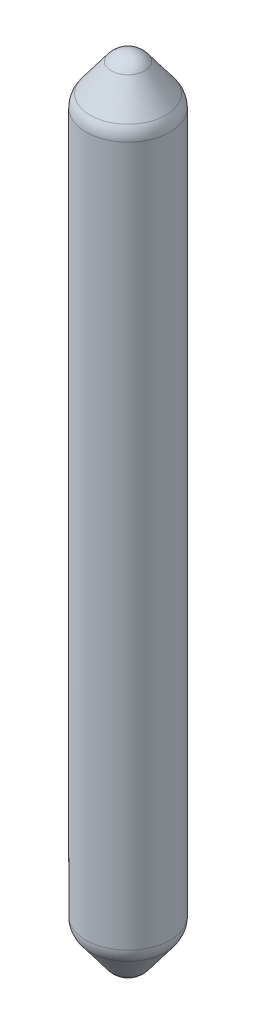
from build123d import *

# Parameters (mm, degrees)
SKETCH1_R           = 20
BOSS_EXTRUDE1_DEPTH = 170
FILLET1_R           = 10


with BuildPart() as part:
    # Sketch1 → Boss-Extrude1 (new, symmetric)
    with BuildSketch(Plane(origin=(0, 0, 0), x_dir=(-1, 0, 0), z_dir=(0, 1, 0))):
        with Locations(Location((0, 0, 0), (0, 0, 90))):
            Circle(SKETCH1_R)
    extrude(amount=BOSS_EXTRUDE1_DEPTH, both=True)

    # Sketch2 → Revolve1 (revolve)
    with BuildSketch(Plane(origin=(0, 0, 0), x_dir=(0, 1, 0), z_dir=(0, 0, 1)), mode=Mode.PRIVATE) as revolve1_sk:
        with BuildLine():
            Line((-170, 20), (-186, 8))
            ThreePointArc((-186, 8), (-188.94427191, 4.472135955), (-190, 0))
            Line((-190, 0), (-180, 0))
            Line((-180, 0), (-170, 0))
            Line((-170, 0), (-170, 20))
        make_face()
    revolve1 = revolve(revolve1_sk.sketch.rotate(Axis((0, -190, 0), (0, 1, 0)), 180), axis=Axis((0, -190, 0), (0, 1, 0)))

    # Mirror2: Revolve1 across plane
    add(revolve1.mirror(Plane.ZX))

    # Fillet1
    fillet1_edges = [part.edges().sort_by_distance(p)[0] for p in [
        (14.142135624, 170, 14.142135624),
        (-14.142135624, -170, -14.142135624),
    ]]
    fillet(fillet1_edges, radius=FILLET1_R)


solid = part.part
